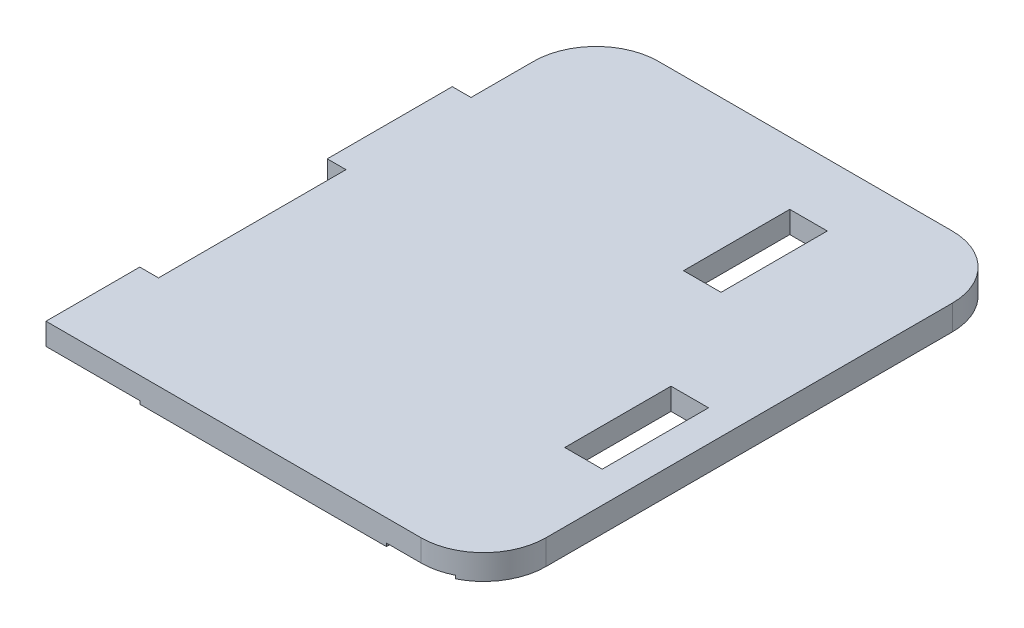
from build123d import *

# Parameters (mm, degrees)
SKETCH1_W           = 0.6
SKETCH1_H           = 1.7
BOSS_EXTRUDE1_DEPTH = 0.4
FILLET2_R           = 1
SKETCH2_W           = 1.5
SKETCH2_H           = 8.5
CUT_EXTRUDE1_DEPTH  = 0.05


with BuildPart() as part:
    # Sketch1 → Boss-Extrude1 (new body)
    with BuildSketch(Plane(origin=(0, 0, 0), x_dir=(1, 0, 0), z_dir=(0, 1, 0))):
        Polygon((0, 0), (7, 0), (7, 8.5), (0.3, 8.5), (0.3, 6.5), (0, 6.5), (0, 4.5), (0.3, 4.5), (0.3, 1.5), (0, 1.5), align=None)
        with Locations((4.7, 6.65)):
            Rectangle(SKETCH1_W, SKETCH1_H, mode=Mode.SUBTRACT)
        with Locations((6.2, 3.25)):
            Rectangle(SKETCH1_W, SKETCH1_H, mode=Mode.SUBTRACT)
    extrude(amount=BOSS_EXTRUDE1_DEPTH)

    # Fillet2
    fillet2_edges = [part.edges().sort_by_distance(p)[0] for p in [
        (0.3, 0.2, -8.5),
        (7, 0.2, -8.5),
        (7, 0.2, 0),
    ]]
    fillet(fillet2_edges, radius=FILLET2_R)

    # Sketch2 → Cut-Extrude1 (cut)
    with BuildSketch(Plane.XZ):
        with BuildLine():
            Line((6.448166538, -2.4), (6.448166538, -5.1))
            ThreePointArc((6.448166538, -5.1), (6.314670512, -5.458517669), (5.979203511, -5.642414377))
            Line((5.979203511, -5.642414377), (4.9, -5.8))
            Line((4.9, -5.8), (4.9, -8.5))
            ThreePointArc((4.9, -8.5), (4.4, -9), (3.9, -8.5))
            Line((3.9, -8.5), (3.9, -5.8))
            Line((3.9, -5.8), (3.9, -5.367707784))
            ThreePointArc((3.9, -5.367707784), (4.021765938, -5.040692502), (4.327755978, -4.872954511))
            Line((4.327755978, -4.872954511), (5.448166538, -4.709351823))
            Line((5.448166538, -4.709351823), (5.448166538, -2.4))
            Line((5.448166538, -2.4), (5.448166538, 0))
            Line((5.448166538, 0), (6.448166538, 0))
            Line((6.448166538, 0), (6.448166538, -2.4))
        make_face()
        with Locations((0.75, -4.25)):
            Rectangle(SKETCH2_W, SKETCH2_H)
    extrude(amount=-CUT_EXTRUDE1_DEPTH, mode=Mode.SUBTRACT)


solid = part.part
